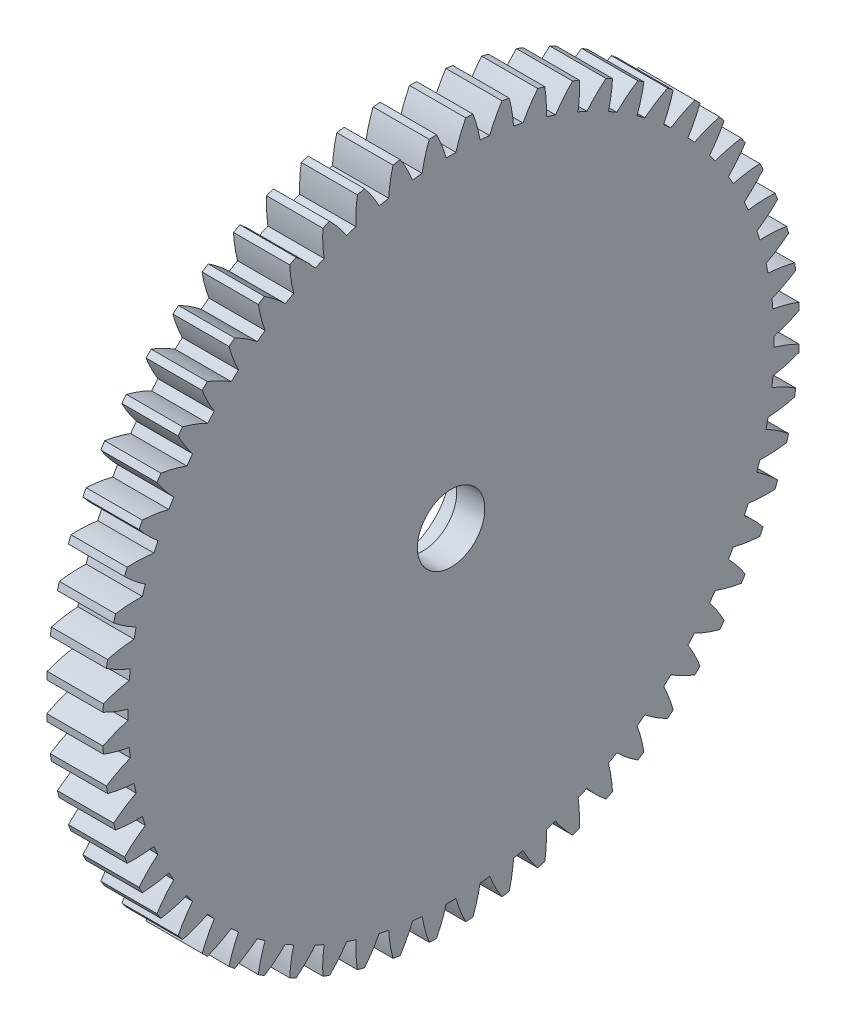
from build123d import *

# Parameters (mm, degrees)
BASPROSKE_W        = 5
BASPROSKE_H        = 31
TOOTHCUT_DEPTH     = 45.124822946
TEETHCUTS_COUNT    = 60
TEETHCUTS_ANGLE    = 354
BORSKE_R           = 3
BORE_DEPTH         = 50.0000508
SKETCH1_R          = 5
CUT_EXTRUDE1_DEPTH = 2.5


with BuildPart() as part:
    # BasProSke → Base-Revolve (revolve)
    with BuildSketch(Plane(origin=(0, 0, 0), x_dir=(1, 0, 0), z_dir=(0, 1, 0)), mode=Mode.PRIVATE) as base_revolve_sk:
        with Locations((2.5, 15.5)):
            Rectangle(BASPROSKE_W, BASPROSKE_H)
    revolve(base_revolve_sk.sketch.rotate(Axis((-10, 0, 0), (1, 0, 0)), 180), axis=Axis((-10, 0, 0), (1, 0, 0)))

    # TooCutSke → ToothCut (cut, through all)
    with BuildSketch(Plane(origin=(0, 0, 0), x_dir=(0, 0, -1), z_dir=(1, 0, 0))):
        with BuildLine():
            ThreePointArc((0.430151971, 28.745781782), (0, 28.749), (-0.430151971, 28.745781782))
            ThreePointArc((-0.430151971, 28.745781782), (-0.81454129, 29.893990802), (-1.312684569, 30.997617721))
            ThreePointArc((-1.312684569, 30.997617721), (0, 31.0254), (1.312684569, 30.997617721))
            ThreePointArc((1.312684569, 30.997617721), (0.81454129, 29.893990802), (0.430151971, 28.745781782))
        make_face()
    toothcut = extrude(amount=TOOTHCUT_DEPTH, mode=Mode.SUBTRACT)

    # TeethCuts: ToothCut ×60 about axis
    teethcuts_axis = Axis((-10, 0, 0), (1, 0, 0))
    for i in range(1, TEETHCUTS_COUNT):
        add(toothcut.rotate(teethcuts_axis, i * TEETHCUTS_ANGLE / (TEETHCUTS_COUNT - 1)), mode=Mode.SUBTRACT)

    # BorSke → Bore (cut, symmetric)
    with BuildSketch(Plane(origin=(0, 0, 0), x_dir=(0, 0, -1), z_dir=(1, 0, 0))):
        with Locations(Location((0, 0, 0), (0, 0, 180))):
            Circle(BORSKE_R)
    extrude(amount=BORE_DEPTH, both=True, mode=Mode.SUBTRACT)

    # Sketch1 → Cut-Extrude1 (cut)
    with BuildSketch(Plane.ZY):
        Circle(SKETCH1_R)
    extrude(amount=-CUT_EXTRUDE1_DEPTH, mode=Mode.SUBTRACT)


solid = part.part
